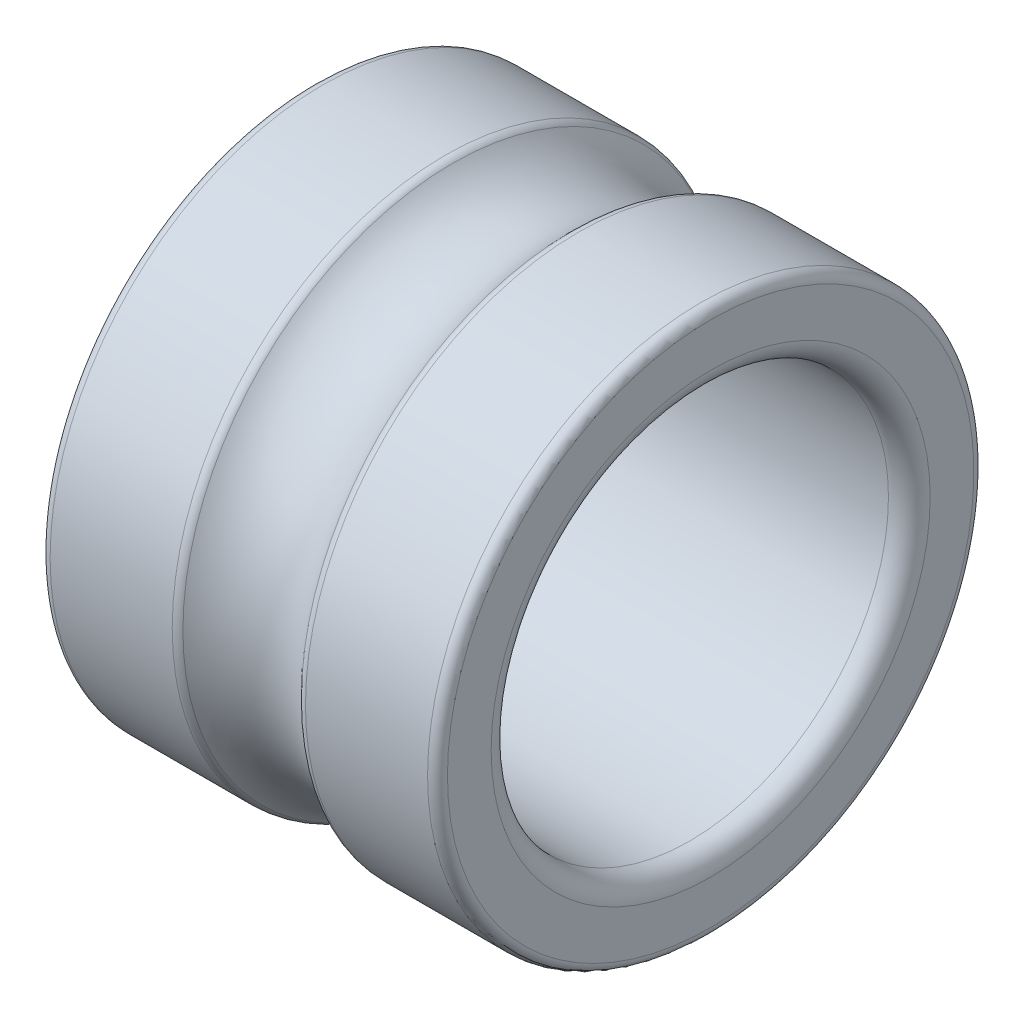
from build123d import *

# Parameters (mm, degrees)
FILLET1_R    = 1
SCALE2_SCALE = 0.1


with BuildPart() as part:
    # Sketch1 → Revolve1 (revolve)
    with BuildSketch(Plane.XY, mode=Mode.PRIVATE) as revolve1_sk:
        with BuildLine():
            Line((-20, 27.5), (-6.244997998, 27.5))
            ThreePointArc((-6.244997998, 27.5), (0, 24.5), (6.244997998, 27.5))
            Line((6.244997998, 27.5), (20, 27.5))
            Line((20, 27.5), (20, 22.1))
            ThreePointArc((20, 22.1), (19.38492424, 20.61507576), (17.9, 20))
            Line((17.9, 20), (-17.9, 20))
            ThreePointArc((-17.9, 20), (-19.38492424, 20.61507576), (-20, 22.1))
            Line((-20, 22.1), (-20, 27.5))
        make_face()
    revolve(revolve1_sk.sketch.rotate(Axis((-65.552679482, 0, 0), (1, 0, 0)), 90), axis=Axis((-65.552679482, 0, 0), (1, 0, 0)))

    # Fillet1
    fillet1_edges = [part.edges().sort_by_distance(p)[0] for p in [
        (-20, 0, -27.5),
        (-6.244997998, 0, -27.5),
        (6.244997998, 0, -27.5),
        (20, 0, -27.5),
    ]]
    fillet(fillet1_edges, radius=FILLET1_R)


with BuildPart() as part_1:
    # Scale2: scaled about (0, 0, -5.2e-08)
    add(part.part.scale(SCALE2_SCALE).moved(Location((0, 0, -4.7e-08))))


solid = part_1.part
